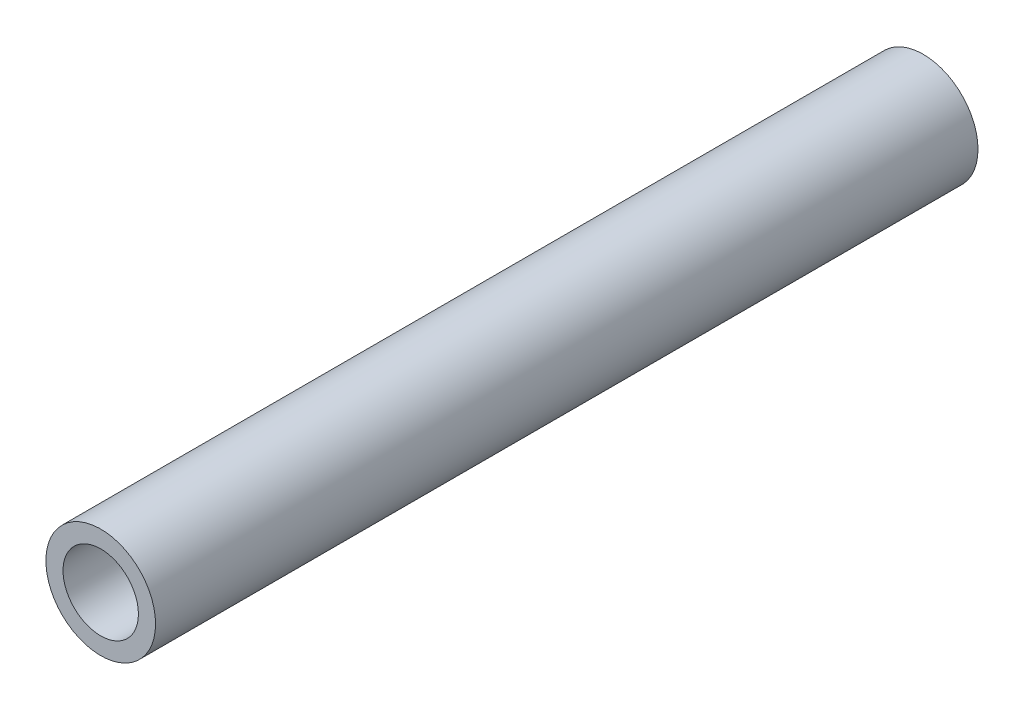
from build123d import *

# Parameters (mm, degrees)
SKETCH1_R            = 4
BOSS_EXTRUDE1_DEPTH  = 60
M5_CLEARANCE_HOLE2_D = 5.5


with BuildPart() as part:
    # Sketch1 → Boss-Extrude1 (new body)
    with BuildSketch(Plane.XY):
        Circle(SKETCH1_R)
    extrude(amount=BOSS_EXTRUDE1_DEPTH)

    # M5 Clearance Hole2 (through all)
    with Locations(Plane.XY.offset(60)):
        with Locations((0, 0)):
            Hole(M5_CLEARANCE_HOLE2_D / 2)


solid = part.part
